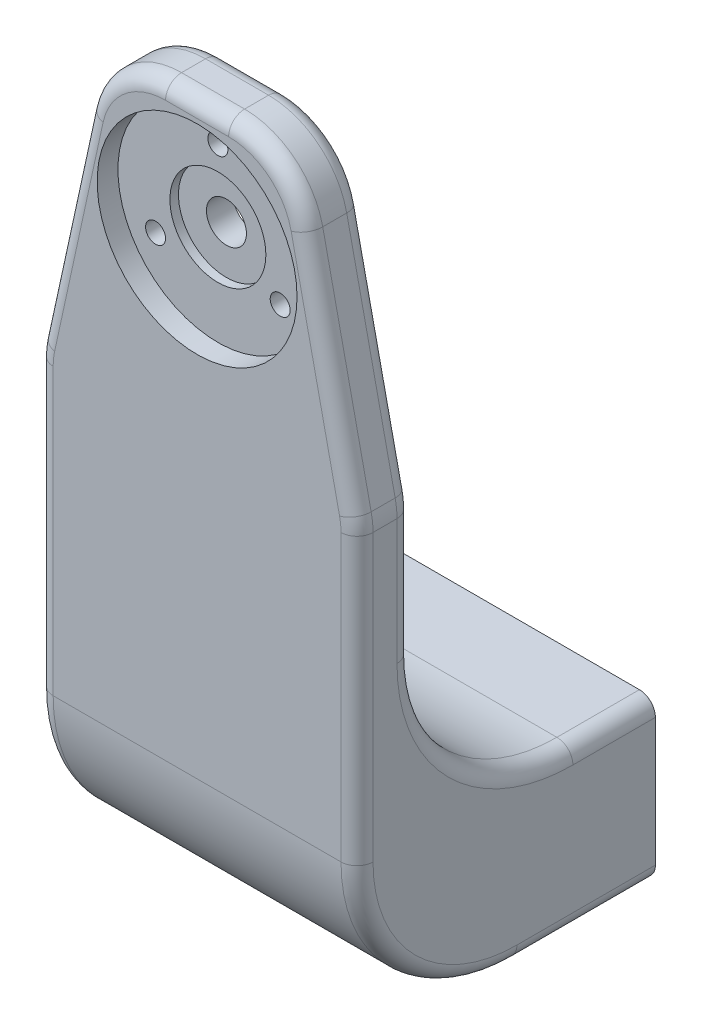
from build123d import *

# Parameters (mm, degrees)
SKETCH1_W           = 40
SKETCH1_H           = 20
BOSS_EXTRUDE4_DEPTH = 35.32
SKETCH3_W           = 40
SKETCH3_H           = 93.52
BOSS_EXTRUDE5_DEPTH = 7
SKETCH4_R           = 12.5
CUT_EXTRUDE1_DEPTH  = 2.6
SKETCH5_R           = 6
CUT_EXTRUDE2_DEPTH  = 1.07
SKETCH6_R           = 2.5
CUT_EXTRUDE3_DEPTH  = 4
SKETCH7_R           = 1.25
CUT_EXTRUDE5_DEPTH  = 6
SKETCH9_R           = 2.7
CUT_EXTRUDE6_DEPTH  = 2
SKETCH10_R          = 1.5
CUT_EXTRUDE8_DEPTH  = 20
FILLET1_R           = 20
FILLET2_R           = 20
SKETCH11_W          = 45.672001295
SKETCH11_H          = 21.162412363
CUT_EXTRUDE9_DEPTH  = 5
CUT_EXTRUDE10_DEPTH = 10
FILLET5_R           = 10
FILLET6_R           = 10
FILLET7_R           = 10
FILLET8_R           = 10
FILLET9_R           = 2
FILLET10_R          = 2


with BuildPart() as part:
    # Sketch1 → Boss-Extrude4 (new body)
    with BuildSketch(Plane.XY):
        with Locations((20, -10)):
            Rectangle(SKETCH1_W, SKETCH1_H)
    extrude(amount=BOSS_EXTRUDE4_DEPTH)

    # Sketch3 → Boss-Extrude5 (add)
    with BuildSketch(Plane.XY.offset(35.32)):
        with Locations((20, 26.76)):
            Rectangle(SKETCH3_W, SKETCH3_H)
    extrude(amount=BOSS_EXTRUDE5_DEPTH)

    # Sketch4 → Cut-Extrude1 (cut)
    with BuildSketch(Plane.XY.offset(42.32)):
        with Locations((20, 58.46128741)):
            Circle(SKETCH4_R)
    extrude(amount=-CUT_EXTRUDE1_DEPTH, mode=Mode.SUBTRACT)

    # Sketch5 → Cut-Extrude2 (cut)
    with BuildSketch(Plane.XY.offset(39.72)):
        with Locations((20, 58.46128741)):
            Circle(SKETCH5_R)
    extrude(amount=-CUT_EXTRUDE2_DEPTH, mode=Mode.SUBTRACT)

    # Sketch6 → Cut-Extrude3 (cut)
    with BuildSketch(Plane.XY.offset(38.65)):
        with Locations((20, 58.46128741)):
            Circle(SKETCH6_R)
    extrude(amount=-CUT_EXTRUDE3_DEPTH, mode=Mode.SUBTRACT)

    # Sketch7 → Cut-Extrude5 (cut)
    with BuildSketch(Plane.XY.offset(39.72)):
        with Locations((27.794228634, 53.96128741)):
            Circle(SKETCH7_R)
        with Locations((12.205771366, 53.96128741)):
            Circle(SKETCH7_R)
        with Locations((20, 67.46128741)):
            Circle(SKETCH7_R)
    extrude(amount=-CUT_EXTRUDE5_DEPTH, mode=Mode.SUBTRACT)

    # Sketch9 → Cut-Extrude6 (cut)
    with BuildSketch(Plane(origin=(0, 0, 35.32), x_dir=(-1, 0, 0), z_dir=(0, 0, -1))):
        with Locations((-27.794228634, 53.96128741)):
            Circle(SKETCH9_R)
        with Locations((-12.205771366, 53.96128741)):
            Circle(SKETCH9_R)
        with Locations((-20, 67.46128741)):
            Circle(SKETCH9_R)
    extrude(amount=-CUT_EXTRUDE6_DEPTH, mode=Mode.SUBTRACT)

    # Sketch10 → Cut-Extrude8 (cut)
    with BuildSketch(Plane(origin=(0, 0, 0), x_dir=(-1, 0, 0), z_dir=(0, 0, -1))):
        with Locations((-30, -10)):
            Circle(SKETCH10_R)
        with Locations((-10, -10)):
            Circle(SKETCH10_R)
    extrude(amount=-CUT_EXTRUDE8_DEPTH, mode=Mode.SUBTRACT)

    # Fillet1
    fillet1_edges = [part.edges().sort_by_distance(p)[0] for p in [
        (20, 0, 35.32),
    ]]
    fillet(fillet1_edges, radius=FILLET1_R)

    # Fillet2
    fillet2_edges = [part.edges().sort_by_distance(p)[0] for p in [
        (20, -20, 42.32),
    ]]
    fillet(fillet2_edges, radius=FILLET2_R)

    # Sketch11 → Cut-Extrude9 (cut)
    with BuildSketch(Plane(origin=(0, 0, 0), x_dir=(-1, 0, 0), z_dir=(0, 0, -1))):
        with Locations((-18.602034722, -10.581206182)):
            Rectangle(SKETCH11_W, SKETCH11_H)
    extrude(amount=-CUT_EXTRUDE9_DEPTH, mode=Mode.SUBTRACT)

    # Sketch12 → Cut-Extrude10 (cut)
    with BuildSketch(Plane.XY.offset(42.32)):
        Polygon((0, 36.76), (8, 73.52), (0, 73.52), align=None)
        Polygon((32, 73.52), (40, 36.76), (40, 73.52), align=None)
    extrude(amount=-CUT_EXTRUDE10_DEPTH, mode=Mode.SUBTRACT)

    # Fillet5
    fillet5_edges = [part.edges().sort_by_distance(p)[0] for p in [
        (8, 73.52, 38.82),
    ]]
    fillet(fillet5_edges, radius=FILLET5_R)

    # Fillet6
    fillet6_edges = [part.edges().sort_by_distance(p)[0] for p in [
        (32, 73.52, 38.82),
    ]]
    fillet(fillet6_edges, radius=FILLET6_R)

    # Fillet7
    fillet7_edges = [part.edges().sort_by_distance(p)[0] for p in [
        (0, 36.76, 38.82),
    ]]
    fillet(fillet7_edges, radius=FILLET7_R)

    # Fillet8
    fillet8_edges = [part.edges().sort_by_distance(p)[0] for p in [
        (40, 36.76, 38.82),
    ]]
    fillet(fillet8_edges, radius=FILLET8_R)

    # Fillet9
    fillet9_edges = [part.edges().sort_by_distance(p)[0] for p in [
        (40, -20, 13.66),
        (40, -14.142135624, 36.462135624),
        (40, 17.842224217, 42.32),
        (39.942656482, 36.753832409, 42.32),
        (36.742387874, 51.728727718, 42.32),
        (30.216559744, 71.306688481, 42.32),
        (20, 73.52, 42.32),
        (9.783440256, 71.306688481, 42.32),
        (3.257612126, 51.728727718, 42.32),
        (0.057343518, 36.753832409, 42.32),
        (0, -20, 13.66),
        (0, -14.142135624, 36.462135624),
        (0, 17.842224217, 42.32),
    ]]
    fillet(fillet9_edges, radius=FILLET9_R)

    # Fillet10
    fillet10_edges = [part.edges().sort_by_distance(p)[0] for p in [
        (40, 0, 10.16),
        (40, 5.857864376, 29.462135624),
        (40, 27.842224217, 35.32),
        (39.942656482, 36.753832409, 35.32),
        (36.742387874, 51.728727718, 35.32),
        (30.216559744, 71.306688481, 35.32),
        (20, 73.52, 35.32),
        (9.783440256, 71.306688481, 35.32),
        (3.257612126, 51.728727718, 35.32),
        (0.057343518, 36.753832409, 35.32),
        (0, 27.842224217, 35.32),
        (0, 0, 10.16),
        (0, 5.857864376, 29.462135624),
    ]]
    fillet(fillet10_edges, radius=FILLET10_R)


solid = part.part
